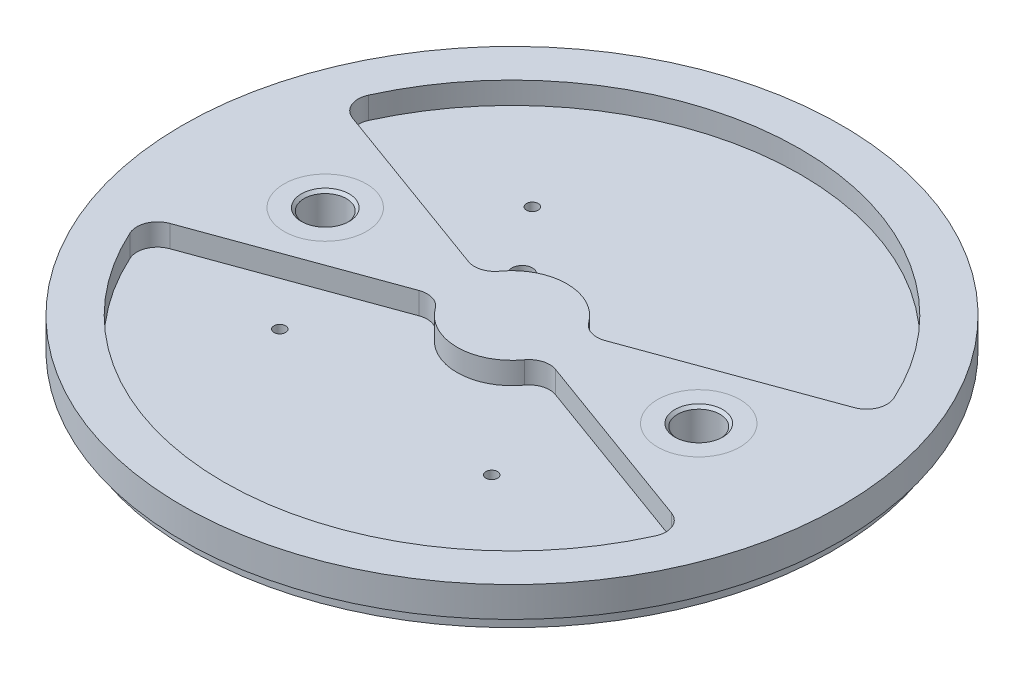
from build123d import *

# Parameters (mm, degrees)
SKETCH1_R                      = 76.2
BOSS_EXTRUDE1_DEPTH            = 10.16
TAP_DRILL_FOR_6_32_TAP1_D      = 2.7051
CIRPATTERN1_COUNT              = 4
W_0_386_DIAMETER_HOLE1_D       = 9.8044
F_3_16_0_1875_DIAMETER_HOLE1_D = 4.7625
CUT_EXTRUDE4_DEPTH             = 3.175
SKETCH15_R                     = 76.2
SKETCH15_R_2                   = 74.041
CUT_EXTRUDE5_DEPTH             = 3.175
CUT_EXTRUDE7_DEPTH             = 5.08
BODY_MOVE_COPY1_ANGLE          = 40
CHAMFER1_SIZE                  = 0.635


with BuildPart() as part:
    # Sketch1 → Boss-Extrude1 (new body)
    with BuildSketch(Plane(origin=(0, 0, 0), x_dir=(1, 0, 0), z_dir=(0, 1, 0))):
        with Locations(Location((0, 0, 0), (0, 0, 270))):
            Circle(SKETCH1_R)
    extrude(amount=BOSS_EXTRUDE1_DEPTH)

    # Tap Drill for #6-32 Tap1 (through all)
    with Locations(Plane(origin=(0, 0, 0), x_dir=(-1, 0, 0), z_dir=(0, -1, 0))):
        with Locations((37.52117539, 6.615995569)):
            tap_drill_for_6_32_tap1 = Hole(TAP_DRILL_FOR_6_32_TAP1_D / 2)

    # CirPattern1: Tap Drill for #6-32 Tap1 ×4 about axis, 1 skipped
    cirpattern1_axis = Axis((0, 0, 0), (0, 1, 0))
    add([tap_drill_for_6_32_tap1.rotate(cirpattern1_axis, i * 360 / CIRPATTERN1_COUNT) for i in range(1, CIRPATTERN1_COUNT) if i not in (3,)], mode=Mode.SUBTRACT)

    # W (0.386) Diameter Hole1 (through all)
    with Locations(Plane(origin=(0, 0, 0), x_dir=(-1, 0, 0), z_dir=(0, -1, 0))):
        with Locations((-33.077799054, 27.755568986), (33.077799054, -27.755568986)):
            Hole(W_0_386_DIAMETER_HOLE1_D / 2)

    # 3/16 (0.1875) Diameter Hole1 (through all)
    with Locations(Plane(origin=(0, 0, 0), x_dir=(-1, 0, 0), z_dir=(0, -1, 0))):
        with Locations((18.760587695, 3.307997785)):
            Hole(F_3_16_0_1875_DIAMETER_HOLE1_D / 2)

    # Sketch12 → Cut-Extrude4 (cut)
    with BuildSketch(Plane.XZ):
        with BuildLine():
            ThreePointArc((24.848558171, 24.575146858), (20.286055568, 24.175979603), (19.886888313, 28.738482206))
            Line((19.886888313, 28.738482206), (6.498907978, 12.783308544))
            ThreePointArc((6.498907978, 12.783308544), (10.087375141, 13.744835423), (12.218242907, 10.70164087))
            ThreePointArc((12.218242907, 10.70164087), (12.02293746, 9.594008636), (11.460577836, 8.619973196))
            Line((11.460577836, 8.619973196), (24.848558171, 24.575146858))
        make_face()
        with BuildLine():
            ThreePointArc((25.606223242, 26.656814532), (23.475355476, 29.700009084), (19.886888313, 28.738482206))
            Line((19.886888313, 28.738482206), (24.848558171, 24.575146858))
            ThreePointArc((24.848558171, 24.575146858), (25.410917794, 25.549182297), (25.606223242, 26.656814532))
        make_face()
        with BuildLine():
            Line((24.848558171, 24.575146858), (19.886888313, 28.738482206))
            ThreePointArc((19.886888313, 28.738482206), (20.286055568, 24.175979603), (24.848558171, 24.575146858))
        make_face()
        with BuildLine():
            ThreePointArc((12.218242907, 10.70164087), (10.087375141, 13.744835423), (6.498907978, 12.783308544))
            Line((6.498907978, 12.783308544), (11.460577836, 8.619973196))
            ThreePointArc((11.460577836, 8.619973196), (12.02293746, 9.594008636), (12.218242907, 10.70164087))
        make_face()
        with BuildLine():
            Line((11.460577836, 8.619973196), (6.498907978, 12.783308544))
            ThreePointArc((6.498907978, 12.783308544), (6.898075233, 8.220805941), (11.460577836, 8.619973196))
        make_face()
    cut_extrude4 = extrude(amount=-CUT_EXTRUDE4_DEPTH, mode=Mode.SUBTRACT)

    # Mirror1: Cut-Extrude4 across plane
    add(cut_extrude4.mirror(Plane(origin=(0, 0, 0), x_dir=(-0.7660444431189792, 0, 0.6427876096865378), z_dir=(0.6427876096865379, 0, 0.7660444431189792))), mode=Mode.SUBTRACT)

    # Sketch15 → Cut-Extrude5 (cut)
    with BuildSketch(Plane.XZ):
        with Locations(Location((0, 0, 0), (0, 0, 270))):
            Circle(SKETCH15_R)
        with Locations(Location((0, 0, 0), (0, 0, 270))):
            Circle(SKETCH15_R_2, mode=Mode.SUBTRACT)
    extrude(amount=-CUT_EXTRUDE5_DEPTH, mode=Mode.SUBTRACT)

    # Sketch20 → Cut-Extrude7 (cut)
    with BuildSketch(Plane(origin=(0, 10.16, 0), x_dir=(1, 0, 0), z_dir=(0, 1, 0))):
        with BuildLine():
            Line((58.006337644, 21.112580301), (15.787325383, 5.746116518))
            ThreePointArc((15.787325383, 5.746116518), (13.41810781, 3.858627578), (12.666324636, 0.92424034))
            ThreePointArc((12.666324636, 0.92424034), (8.163402625, -9.728764443), (-3.109683289, -12.313402042))
            ThreePointArc((-3.109683289, -12.313402042), (-6.130036388, -12.544212982), (-8.400260426, -14.549677855))
            Line((-8.400260426, -14.549677855), (-30.864527746, -53.458930208))
            ThreePointArc((-30.864527746, -53.458930208), (-31.28945063, -57.248955123), (-28.797011077, -60.135578304))
            ThreePointArc((-28.797011077, -60.135578304), (42.857863777, -51.076013328), (64.222532311, 17.917085938))
            ThreePointArc((64.222532311, 17.917085938), (61.812570917, 20.872916849), (58.006337644, 21.112580301))
        make_face()
        with BuildLine():
            Line((8.400260408, 14.549677823), (30.864527463, 53.458929718))
            ThreePointArc((30.864527463, 53.458929718), (31.289450636, 57.248955104), (28.797010604, 60.135578531))
            ThreePointArc((28.797010604, 60.135578531), (-42.857863971, 51.076013165), (-64.222532316, -17.91708592))
            ThreePointArc((-64.222532316, -17.91708592), (-61.812570882, -20.872916867), (-58.006337553, -21.112580268))
            Line((-58.006337553, -21.112580268), (-15.787325417, -5.746116531))
            ThreePointArc((-15.787325417, -5.746116531), (-13.418107797, -3.858627558), (-12.666324642, -0.924240256))
            ThreePointArc((-12.666324642, -0.924240256), (-8.16340261, 9.728764456), (3.109683246, 12.313402053))
            ThreePointArc((3.109683246, 12.313402053), (6.130036351, 12.544212967), (8.400260408, 14.549677823))
        make_face()
    extrude(amount=-CUT_EXTRUDE7_DEPTH, mode=Mode.SUBTRACT)


with BuildPart() as part_1:
    # Body-Move/Copy1: moved
    add(part.part.rotate(Axis((0, 0, 0), (0, -1, 0)), BODY_MOVE_COPY1_ANGLE))

    # Chamfer1
    chamfer1_edges = [part_1.edges().sort_by_distance(p)[0] for p in [
        (-46.935303069, 0, -3.15107342),
        (-46.935303069, 10.16, -3.15107342),
        (39.424696931, 0, -3.15107342),
        (39.424696931, 10.16, -3.15107342),
    ]]
    chamfer(chamfer1_edges, length=CHAMFER1_SIZE)


solid = part_1.part
